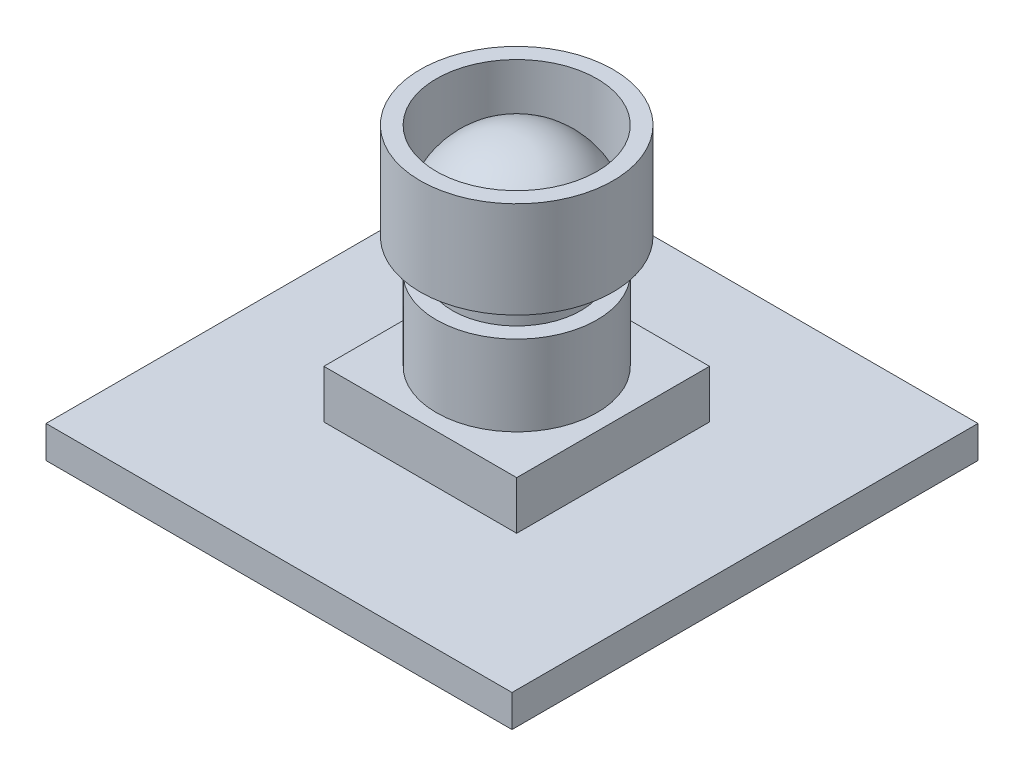
from build123d import *

# Parameters (mm, degrees)
SKETCH1_W           = 29
SKETCH1_H           = 29
BOSS_EXTRUDE1_DEPTH = 2
SKETCH2_W           = 12
SKETCH2_H           = 12
BOSS_EXTRUDE2_DEPTH = 3
SKETCH5_R           = 5
BOSS_EXTRUDE3_DEPTH = 5
SKETCH6_R           = 4
BOSS_EXTRUDE4_DEPTH = 2
SKETCH8_R           = 6
SKETCH8_R_2         = 5
EXTRUDE_THIN2_DEPTH = 6
SKETCH9_R           = 5
BOSS_EXTRUDE5_DEPTH = 0.5
REVOLVE1_ANGLE      = 180


with BuildPart() as part:
    # Sketch1 → Boss-Extrude1 (new body)
    with BuildSketch(Plane(origin=(0, 0, 0), x_dir=(1, 0, 0), z_dir=(0, 1, 0))):
        with Locations((14.5, 14.5)):
            Rectangle(SKETCH1_W, SKETCH1_H)
    extrude(amount=BOSS_EXTRUDE1_DEPTH)

    # Sketch2 → Boss-Extrude2 (add)
    with BuildSketch(Plane(origin=(0, 2, 0), x_dir=(1, 0, 0), z_dir=(0, 1, 0))):
        with Locations((14.566374873, 14.72560783)):
            Rectangle(SKETCH2_W, SKETCH2_H)
    extrude(amount=BOSS_EXTRUDE2_DEPTH)

    # Sketch5 → Boss-Extrude3 (add)
    with BuildSketch(Plane(origin=(0, 5, 0), x_dir=(1, 0, 0), z_dir=(0, 1, 0))):
        with Locations((14.566374873, 14.72560783)):
            Circle(SKETCH5_R)
    extrude(amount=BOSS_EXTRUDE3_DEPTH)

    # Sketch6 → Boss-Extrude4 (add)
    with BuildSketch(Plane(origin=(0, 10, 0), x_dir=(1, 0, 0), z_dir=(0, 1, 0))):
        with Locations((14.566374873, 14.72560783)):
            Circle(SKETCH6_R)
    extrude(amount=BOSS_EXTRUDE4_DEPTH)



with BuildPart() as body_2:
    # Sketch8 → Extrude-Thin2 (new body)
    with BuildSketch(Plane(origin=(0, 12, 0), x_dir=(1, 0, 0), z_dir=(0, 1, 0))):
        with Locations((14.566374873, 14.72560783)):
            Circle(SKETCH8_R)
        with Locations((14.566374873, 14.72560783)):
            Circle(SKETCH8_R_2, mode=Mode.SUBTRACT)
    extrude(amount=EXTRUDE_THIN2_DEPTH)


with BuildPart() as part_1:
    add(part.part)

    add(body_2.part)  # Boss-Extrude5 merges body 2
    # Sketch9 → Boss-Extrude5 (add)
    with BuildSketch(Plane(origin=(0, 12, 0), x_dir=(1, 0, 0), z_dir=(0, 1, 0))):
        with Locations((14.566374873, 14.72560783)):
            Circle(SKETCH9_R)
    extrude(amount=BOSS_EXTRUDE5_DEPTH)

    # Sketch13 → Revolve1 (revolve)
    with BuildSketch(Plane(origin=(0, 12.5, 0), x_dir=(1, 0, 0), z_dir=(0, 1, 0))):
        with BuildLine():
            Line((9.847526331, 16.378625808), (19.285223415, 13.072589852))
            ThreePointArc((19.285223415, 13.072589852), (16.219392851, 19.444456372), (9.847526331, 16.378625808))
        make_face()
    revolve(axis=Axis((9.847526331, 12.5, -16.378625808), (0.9437697084535585, 0, 0.33060359557253066)), revolution_arc=REVOLVE1_ANGLE)


solid = part_1.part
